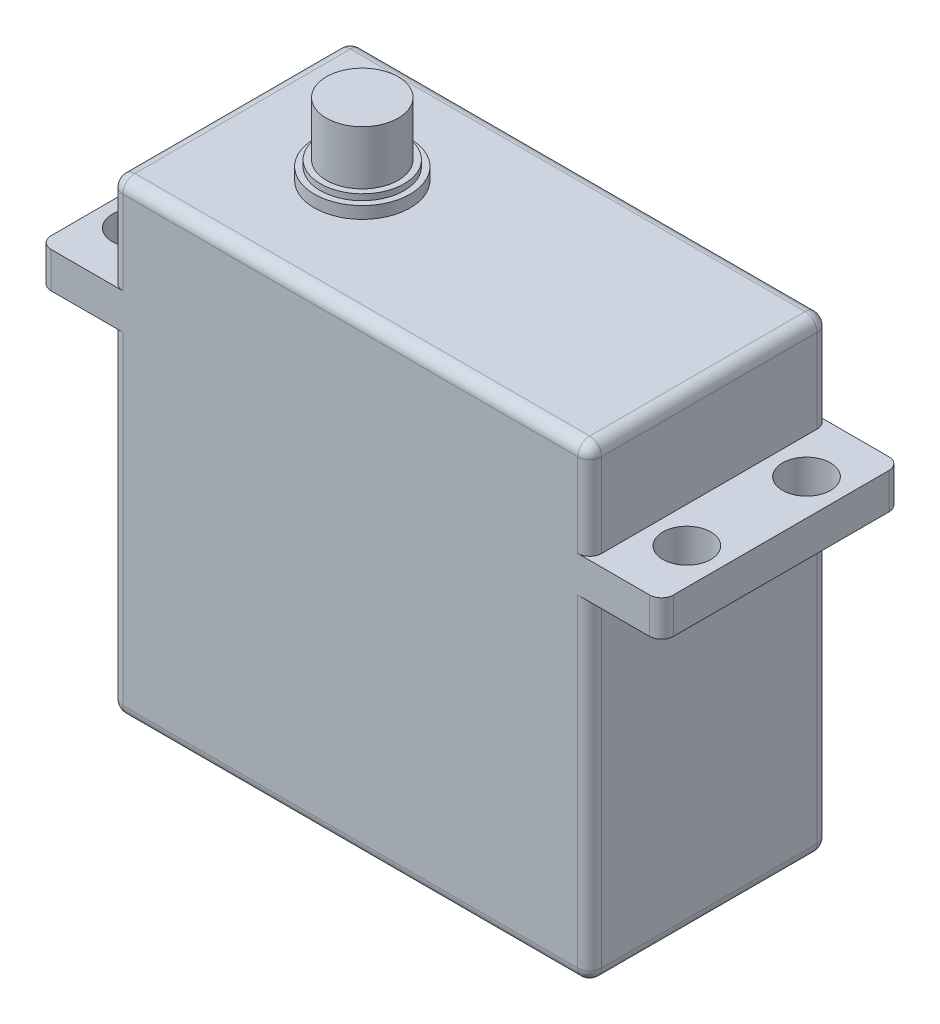
from build123d import *

# Parameters (mm, degrees)
SKETCH_2_W          = 40
SKETCH_2_H          = 39
EXTRUDE_1_DEPTH     = 20
SKETCH_3_R          = 4
EXTRUDE_2_DEPTH     = 1
SKETCH_4_R          = 3.5
EXTRUDE_3_DEPTH     = 0.5
SKETCH_6_R          = 3
EXTRUDE_4_DEPTH     = 4.5
SKETCH_7_W          = 20
SKETCH_7_H          = 3
EXTRUDE_5_DEPTH     = 6
SKETCH_8_R          = 2
CUT_EXTRUDE_1_DEPTH = 6
FILLET_6_R          = 1
FILLET_7_R          = 1
FILLET_8_R          = 1
FILLET_9_R          = 1
FILLET_10_R         = 1
FILLET_11_R         = 1
FILLET_12_R         = 1


with BuildPart() as part:
    # 草图2 → 凸台-拉伸1 (new body)
    with BuildSketch(Plane.XY):
        Rectangle(SKETCH_2_W, SKETCH_2_H)
    extrude(amount=EXTRUDE_1_DEPTH)

    # 草图3 → 凸台-拉伸2 (add)
    with BuildSketch(Plane(origin=(0, 19.5, 0), x_dir=(1, 0, 0), z_dir=(0, 1, 0))):
        with Locations(Location((-9, -10, 0), (0, 0, 90))):
            Circle(SKETCH_3_R)
    extrude(amount=EXTRUDE_2_DEPTH)

    # 草图4 → 凸台-拉伸3 (add)
    with BuildSketch(Plane(origin=(0, 20.5, 0), x_dir=(1, 0, 0), z_dir=(0, 1, 0))):
        with Locations(Location((-9, -10, 0), (0, 0, 270))):
            Circle(SKETCH_4_R)
    extrude(amount=EXTRUDE_3_DEPTH)

    # 草图6 → 凸台-拉伸4 (add)
    with BuildSketch(Plane(origin=(0, 21, 0), x_dir=(1, 0, 0), z_dir=(0, 1, 0))):
        with Locations(Location((-9, -10, 0), (0, 0, 270))):
            Circle(SKETCH_6_R)
    extrude(amount=EXTRUDE_4_DEPTH)

    # 草图7 → 凸台-拉伸5 (add)
    with BuildSketch(Plane.ZY.offset(20)):
        with Locations((10, 10)):
            Rectangle(SKETCH_7_W, SKETCH_7_H)
    extrude_5 = extrude(amount=EXTRUDE_5_DEPTH)

    # 草图8 → 切除-拉伸1 (cut)
    with BuildSketch(Plane(origin=(0, 11.5, 0), x_dir=(1, 0, 0), z_dir=(0, 1, 0))):
        with Locations(Location((-23, -4.880823414, 0), (0, 0, 180))):
            Circle(SKETCH_8_R)
        with Locations(Location((-23, -14.880823414, 0), (0, 0, 180))):
            Circle(SKETCH_8_R)
    cut_extrude_1 = extrude(amount=-CUT_EXTRUDE_1_DEPTH, mode=Mode.SUBTRACT)

    # 镜向3: 凸台-拉伸5, 切除-拉伸1 across plane
    add(extrude_5.mirror(Plane(origin=(0, 0, 0), x_dir=(0, 0, 1), z_dir=(1, 0, 0))))
    add(cut_extrude_1.mirror(Plane(origin=(0, 0, 0), x_dir=(0, 0, 1), z_dir=(1, 0, 0))), mode=Mode.SUBTRACT)

    # 圆角6
    fillet_6_edges = [part.edges().sort_by_distance(p)[0] for p in [
        (-20, -19.5, 10),
    ]]
    fillet(fillet_6_edges, radius=FILLET_6_R)

    # 圆角7
    fillet_7_edges = [part.edges().sort_by_distance(p)[0] for p in [
        (20, -19.5, 10),
    ]]
    fillet(fillet_7_edges, radius=FILLET_7_R)

    # 圆角8
    fillet_8_edges = [part.edges().sort_by_distance(p)[0] for p in [
        (20, 19.5, 10),
    ]]
    fillet(fillet_8_edges, radius=FILLET_8_R)

    # 圆角9
    fillet_9_edges = [part.edges().sort_by_distance(p)[0] for p in [
        (-20, 19.5, 10),
    ]]
    fillet(fillet_9_edges, radius=FILLET_9_R)

    # 圆角10
    fillet_10_edges = [part.edges().sort_by_distance(p)[0] for p in [
        (-26, 10, 20),
        (-26, 10, 0),
    ]]
    fillet(fillet_10_edges, radius=FILLET_10_R)

    # 圆角11
    fillet_11_edges = [part.edges().sort_by_distance(p)[0] for p in [
        (26, 10, 0),
        (26, 10, 20),
    ]]
    fillet(fillet_11_edges, radius=FILLET_11_R)

    # 圆角12
    fillet_12_edges = [part.edges().sort_by_distance(p)[0] for p in [
        (-20, 15, 20),
        (-20, 15, 0),
        (-19.707106781, 19.207106781, 0),
        (-19.707106781, 19.207106781, 20),
        (-20, -5, 0),
        (-20, -5, 20),
        (20, 15, 0),
        (20, 15, 20),
        (0, -19.5, 0),
        (0, -19.5, 20),
        (-19.707106781, -19.207106781, 0),
        (-19.707106781, -19.207106781, 20),
        (20, -5, 20),
        (20, -5, 0),
        (19.707106781, -19.207106781, 0),
        (19.707106781, -19.207106781, 20),
        (0, 19.5, 0),
        (0, 19.5, 20),
        (19.707106781, 19.207106781, 0),
        (19.707106781, 19.207106781, 20),
    ]]
    fillet(fillet_12_edges, radius=FILLET_12_R)


solid = part.part
